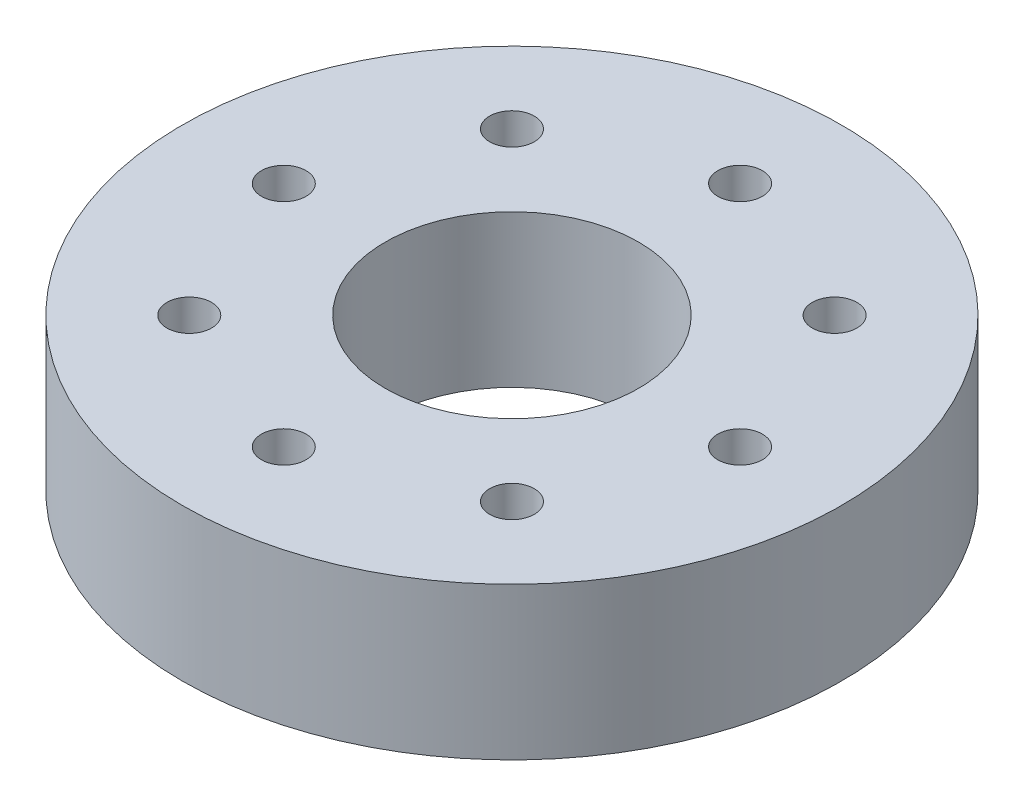
from build123d import *

# Parameters (mm, degrees)
SKETCH1_R           = 32.5
BOSS_EXTRUDE1_DEPTH = 15
SKETCH2_R           = 2.2
CUT_EXTRUDE1_DEPTH  = 49.347699015
SKETCH3_R           = 12.5
CUT_EXTRUDE2_DEPTH  = 49.347699015


with BuildPart() as part:
    # Sketch1 → Boss-Extrude1 (new body)
    with BuildSketch(Plane(origin=(0, 0, 0), x_dir=(1, 0, 0), z_dir=(0, 1, 0))):
        with Locations(Location((0, 0, 0), (0, 0, 270))):
            Circle(SKETCH1_R)
    extrude(amount=BOSS_EXTRUDE1_DEPTH)

    # Sketch2 → Cut-Extrude1 (cut, through all)
    with BuildSketch(Plane(origin=(0, 15, 0), x_dir=(1, 0, 0), z_dir=(0, 1, 0))):
        with Locations(Location((0, 22.5, 0), (0, 0, 270))):
            Circle(SKETCH2_R)
        with Locations(Location((15.909902577, 15.909902577, 0), (0, 0, 270))):
            Circle(SKETCH2_R)
        with Locations(Location((22.5, 0, 0), (0, 0, 270))):
            Circle(SKETCH2_R)
        with Locations(Location((15.909902577, -15.909902577, 0), (0, 0, 270))):
            Circle(SKETCH2_R)
        with Locations(Location((0, -22.5, 0), (0, 0, 270))):
            Circle(SKETCH2_R)
        with Locations(Location((-15.909902577, -15.909902577, 0), (0, 0, 270))):
            Circle(SKETCH2_R)
        with Locations(Location((-22.5, 0, 0), (0, 0, 270))):
            Circle(SKETCH2_R)
        with Locations(Location((-15.909902577, 15.909902577, 0), (0, 0, 270))):
            Circle(SKETCH2_R)
    extrude(amount=-CUT_EXTRUDE1_DEPTH, mode=Mode.SUBTRACT)

    # Sketch3 → Cut-Extrude2 (cut, through all)
    with BuildSketch(Plane(origin=(0, 15, 0), x_dir=(1, 0, 0), z_dir=(0, 1, 0))):
        with Locations(Location((0, 0, 0), (0, 0, 270))):
            Circle(SKETCH3_R)
    extrude(amount=-CUT_EXTRUDE2_DEPTH, mode=Mode.SUBTRACT)


solid = part.part
